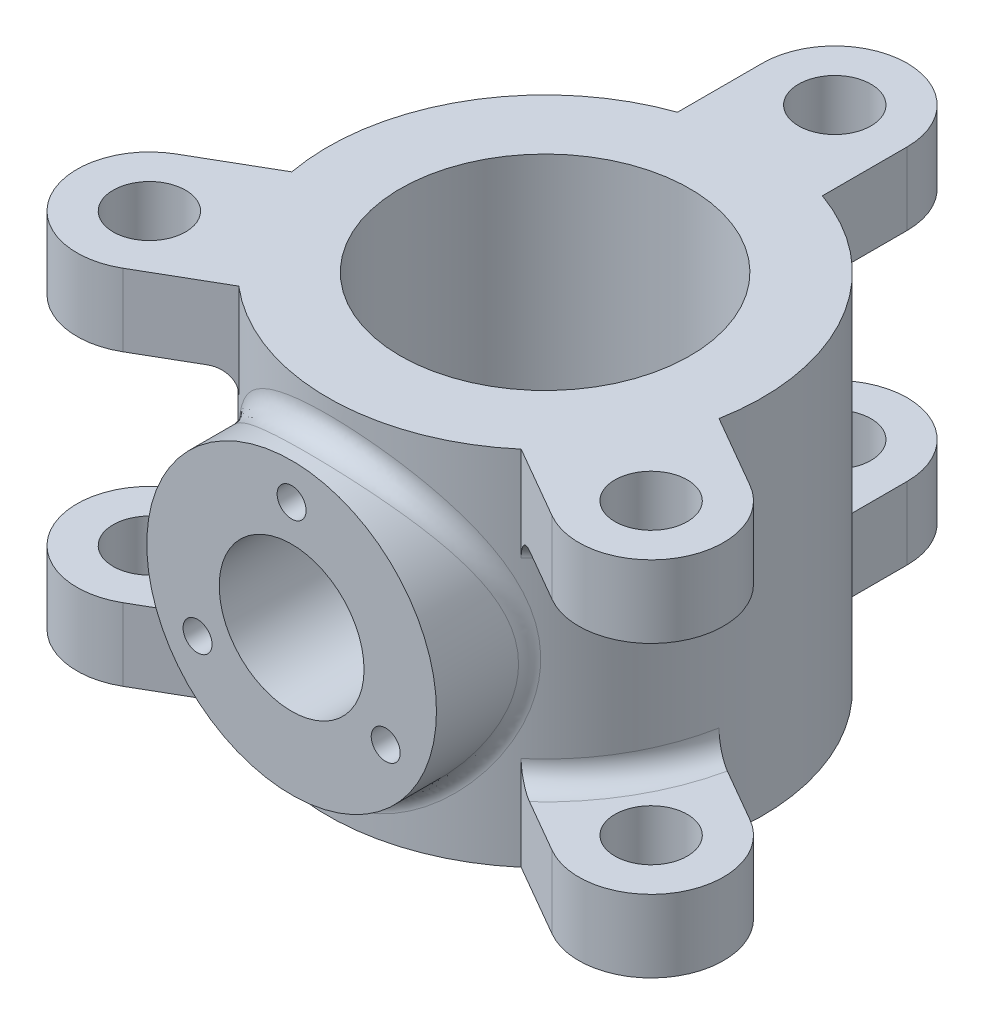
from build123d import *

# Parameters (mm, degrees)
SKETCH1_R                = 30
SKETCH1_R_2              = 20
BOSS_EXTRUDE1_DEPTH      = 25
BOSS_EXTRUDE2_START      = 25
BOSS_EXTRUDE2_DEPTH      = 10
CIRPATTERN1_COUNT        = 3
MIRROR1_START            = 25
MIRROR1_COPY_1_DEPTH     = 10
MIRROR1_COPY_2_DEPTH     = 10
BOSS_EXTRUDE3_REACH      = 101.211
BOSS_EXTRUDE3_END_RADIUS = 30
SKETCH2_R                = 20
SKETCH2_R_2              = 10
SKETCH3_R                = 2
CUT_EXTRUDE1_DEPTH       = 10
CIRPATTERN2_COUNT        = 3
SKETCH2_2_R              = 10
CUT_EXTRUDE2_DEPTH       = 40
FILLET1_R                = 3


with BuildPart() as part:
    # Sketch1 → Boss-Extrude1 (new, symmetric)
    with BuildSketch(Plane(origin=(0, 0, 0), x_dir=(1, 0, 0), z_dir=(0, 1, 0))):
        with Locations(Location((0, 0, 0), (0, 0, 270))):
            Circle(SKETCH1_R)
        with Locations(Location((0, 0, 0), (0, 0, 270))):
            Circle(SKETCH1_R_2, mode=Mode.SUBTRACT)
    extrude(amount=BOSS_EXTRUDE1_DEPTH, both=True)

    # Sketch1<3> → Boss-Extrude2 (add)
    with BuildSketch(Plane(origin=(0, 0, 0), x_dir=(1, 0, 0), z_dir=(0, 1, 0)).offset(BOSS_EXTRUDE2_START)):
        with BuildLine():
            Line((0, 35), (0, 30))
            ThreePointArc((0, 30), (5.073059362, 29.56795679), (10, 28.284271247))
            Line((10, 28.284271247), (10, 40))
            ThreePointArc((10, 40), (7.071067812, 47.071067812), (0, 50))
            Line((0, 50), (0, 45))
            ThreePointArc((0, 45), (3.535533906, 43.535533906), (5, 40))
            ThreePointArc((5, 40), (3.535533906, 36.464466094), (0, 35))
        make_face()
        with BuildLine():
            ThreePointArc((-10, 28.284271247), (-5.073059362, 29.56795679), (0, 30))
            Line((0, 30), (0, 35))
            ThreePointArc((0, 35), (-5, 40), (0, 45))
            Line((0, 45), (0, 50))
            ThreePointArc((0, 50), (-7.071067812, 47.071067812), (-10, 40))
            Line((-10, 40), (-10, 28.284271247))
        make_face()
    boss_extrude2 = extrude(amount=-BOSS_EXTRUDE2_DEPTH)

    # CirPattern1: Boss-Extrude2 ×3 about axis
    cirpattern1_axis = Axis((0, 0, 0), (0, 1, 0))
    for i in range(1, CIRPATTERN1_COUNT):
        add(boss_extrude2.rotate(cirpattern1_axis, i * 360 / CIRPATTERN1_COUNT))

    # Mirror1: Boss-Extrude2 across plane
    add(boss_extrude2.mirror(Plane.ZX))

    # Mirror1 copy 1 sketch → Mirror1 copy 1 (add)
    with BuildSketch(Plane(origin=(0, 0, 0), x_dir=(-0.4999999999999998, 0, -0.8660254037844387), z_dir=(0, -1, 0)).offset(MIRROR1_START)):
        with BuildLine():
            Line((0, -35), (0, -30))
            ThreePointArc((0, -30), (5.073059362, -29.56795679), (10, -28.284271247))
            Line((10, -28.284271247), (10, -40))
            ThreePointArc((10, -40), (7.071067812, -47.071067812), (0, -50))
            Line((0, -50), (0, -45))
            ThreePointArc((0, -45), (3.535533906, -43.535533906), (5, -40))
            ThreePointArc((5, -40), (3.535533906, -36.464466094), (0, -35))
        make_face()
        with BuildLine():
            ThreePointArc((-10, -28.284271247), (-5.073059362, -29.56795679), (0, -30))
            Line((0, -30), (0, -35))
            ThreePointArc((0, -35), (-5, -40), (0, -45))
            Line((0, -45), (0, -50))
            ThreePointArc((0, -50), (-7.071067812, -47.071067812), (-10, -40))
            Line((-10, -40), (-10, -28.284271247))
        make_face()
    extrude(amount=-MIRROR1_COPY_1_DEPTH)

    # Mirror1 copy 2 sketch → Mirror1 copy 2 (add)
    with BuildSketch(Plane(origin=(0, 0, 0), x_dir=(-0.5000000000000004, 0, 0.8660254037844384), z_dir=(0, -1, 0)).offset(MIRROR1_START)):
        with BuildLine():
            Line((0, -35), (0, -30))
            ThreePointArc((0, -30), (5.073059362, -29.56795679), (10, -28.284271247))
            Line((10, -28.284271247), (10, -40))
            ThreePointArc((10, -40), (7.071067812, -47.071067812), (0, -50))
            Line((0, -50), (0, -45))
            ThreePointArc((0, -45), (3.535533906, -43.535533906), (5, -40))
            ThreePointArc((5, -40), (3.535533906, -36.464466094), (0, -35))
        make_face()
        with BuildLine():
            ThreePointArc((-10, -28.284271247), (-5.073059362, -29.56795679), (0, -30))
            Line((0, -30), (0, -35))
            ThreePointArc((0, -35), (-5, -40), (0, -45))
            Line((0, -45), (0, -50))
            ThreePointArc((0, -50), (-7.071067812, -47.071067812), (-10, -40))
            Line((-10, -40), (-10, -28.284271247))
        make_face()
    extrude(amount=-MIRROR1_COPY_2_DEPTH)

    # Boss-Extrude3: up to this cylinder (the profile starts outside it)
    boss_extrude3_end = Plane(origin=(0, 0, 0), z_dir=(0, -1, 0)) * Cylinder(BOSS_EXTRUDE3_END_RADIUS, 263.422, mode=Mode.PRIVATE)
    # Sketch2 → Boss-Extrude3 (add, up to the surface)
    with BuildSketch(Plane.XY.offset(35), mode=Mode.PRIVATE) as boss_extrude3_sk1:
        Circle(SKETCH2_R)
        Circle(SKETCH2_R_2, mode=Mode.SUBTRACT)
    boss_extrude3_tool1 = extrude(boss_extrude3_sk1.sketch, amount=-BOSS_EXTRUDE3_REACH, mode=Mode.PRIVATE) - boss_extrude3_end
    add(boss_extrude3_tool1.solids().sort_by_distance((-19.434315, 0, 35))[0])

    # Sketch3 → Cut-Extrude1 (cut)
    with BuildSketch(Plane.XY.offset(35)):
        with Locations((0, 15)):
            Circle(SKETCH3_R)
    cut_extrude1 = extrude(amount=-CUT_EXTRUDE1_DEPTH, mode=Mode.SUBTRACT)

    # CirPattern2: Cut-Extrude1 ×3 about axis
    cirpattern2_axis = Axis((0, 0, 0), (0, 0, 1))
    for i in range(1, CIRPATTERN2_COUNT):
        add(cut_extrude1.rotate(cirpattern2_axis, i * 360 / CIRPATTERN2_COUNT), mode=Mode.SUBTRACT)

    # Sketch2<2> → Cut-Extrude2 (cut)
    with BuildSketch(Plane.XY.offset(35)):
        Circle(SKETCH2_2_R)
    extrude(amount=-CUT_EXTRUDE2_DEPTH, mode=Mode.SUBTRACT)

    # Fillet1
    fillet1_edges = [part.edges().sort_by_distance(p)[0] for p in [
        (0, 15, -30),
        (-25.980762114, 15, 15),
        (25.980762114, 15, 15),
        (0, -15, -30),
        (-25.980762114, -15, 15),
        (25.980762114, -15, 15),
        (-20, 0, 22.360679775),
    ]]
    fillet(fillet1_edges, radius=FILLET1_R)


solid = part.part
